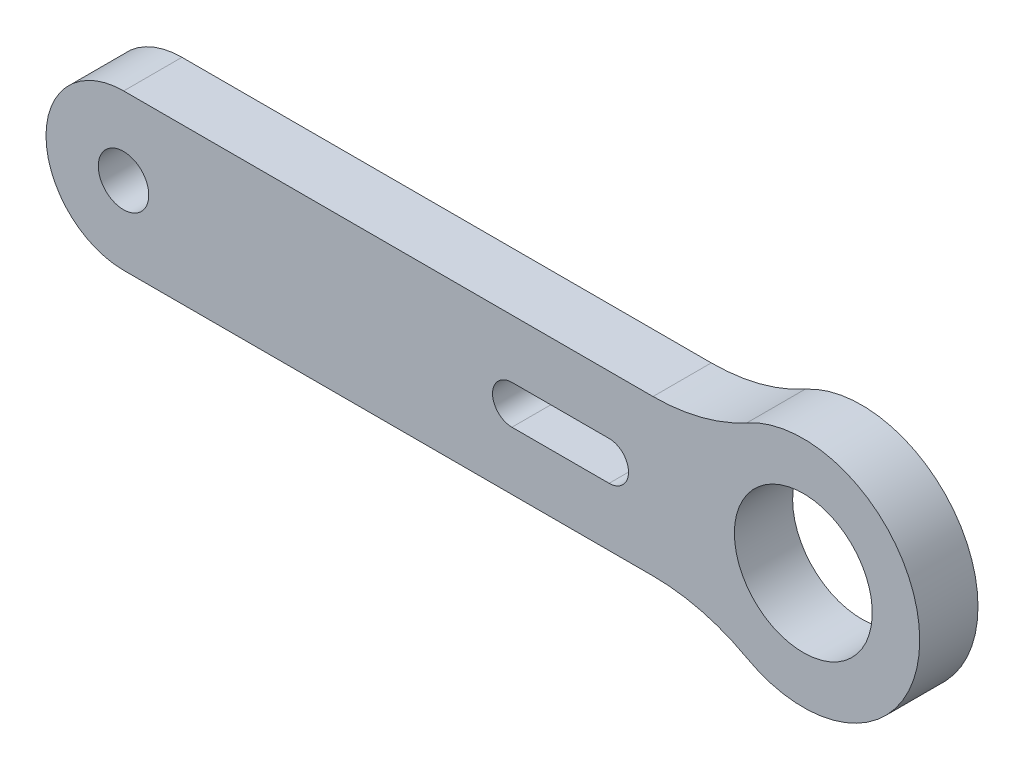
from build123d import *

# Parameters (mm, degrees)
SKETCH_1_R      = 3.55
SKETCH_1_R_2    = 1.3
EXTRUDE_1_DEPTH = 3


with BuildPart() as part:
    # 草图1 → 凸台-拉伸1 (new body)
    with BuildSketch(Plane.XY.offset(3)):
        with BuildLine():
            Line((-11.611020882, 0), (15.646226321, 0))
            ThreePointArc((15.646226321, 0), (18.142339112, -0.316538794), (20.480428598, -1.246115814))
            ThreePointArc((20.480428598, -1.246115814), (29.372947843, 4.002649377), (20.478403544, 9.247982185))
            ThreePointArc((20.478403544, 9.247982185), (18.13880451, 8.317020651), (15.64082314, 8))
            Line((15.64082314, 8), (-11.611020882, 8))
            ThreePointArc((-11.611020882, 8), (-15.611020882, 4), (-11.611020882, 0))
        make_face()
        with Locations(Location((23.379334845, 4.0005, 0), (0, 0, 180))):
            Circle(SKETCH_1_R, mode=Mode.SUBTRACT)
        with Locations(Location((-11.619385977, 4.000182729, 0), (0, 0, 180))):
            Circle(SKETCH_1_R_2, mode=Mode.SUBTRACT)
        with BuildLine():
            Line((8.378847398, 5), (13.380380647, 5))
            ThreePointArc((13.380380647, 5), (14.380114023, 4.000266624), (13.380380647, 3.000533249))
            Line((13.380380647, 3.000533249), (8.378847398, 3.000533249))
            ThreePointArc((8.378847398, 3.000533249), (7.379114023, 4.000266624), (8.378847398, 5))
        make_face(mode=Mode.SUBTRACT)
    extrude(amount=-EXTRUDE_1_DEPTH)


solid = part.part
